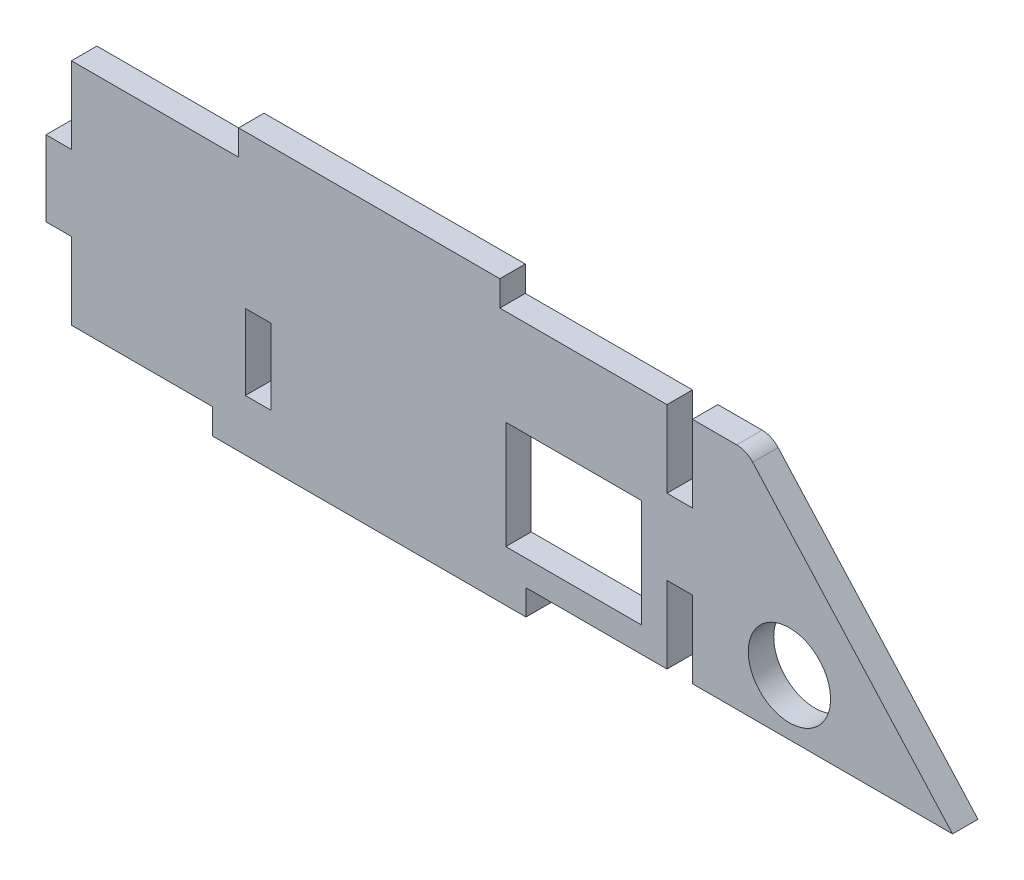
from build123d import *

# Parameters (mm, degrees)
SKETCH_1_W          = 76.2
SKETCH_1_H          = 30
EXTRUDE_1_DEPTH     = 3
SKETCH_2_W          = 19.6215
SKETCH_2_H          = 3
CUT_EXTRUDE_1_DEPTH = 3
SKETCH_3_W          = 3
SKETCH_3_H          = 9.055
CUT_EXTRUDE_2_DEPTH = 3
EXTRUDE_2_DEPTH     = 3
SKETCH_6_W          = 30.7975
SKETCH_6_H          = 3
EXTRUDE_3_DEPTH     = 3
SKETCH_7_W          = 16.002
SKETCH_7_H          = 12.7
CUT_EXTRUDE_3_DEPTH = 3
SKETCH_8_R          = 4.85
CUT_EXTRUDE_4_DEPTH = 3
FILLET_1_R          = 2.54
SKETCH_9_W          = 3
SKETCH_9_H          = 8.89
CUT_EXTRUDE_5_DEPTH = 3


with BuildPart() as part:
    # 스케치1 → 보스-돌출1 (new body)
    with BuildSketch(Plane.XY):
        Rectangle(SKETCH_1_W, SKETCH_1_H)
    extrude(amount=EXTRUDE_1_DEPTH)

    # 스케치2 → 컷-돌출1 (cut)
    with BuildSketch(Plane.XY.offset(3)):
        with Locations((-28.28925, -13.5)):
            Rectangle(SKETCH_2_W, SKETCH_2_H)
        with Locations((28.28925, -13.5)):
            Rectangle(SKETCH_2_W, SKETCH_2_H)
    extrude(amount=-CUT_EXTRUDE_1_DEPTH, mode=Mode.SUBTRACT)

    # 스케치3 → 컷-돌출2 (cut)
    with BuildSketch(Plane.XY.offset(3)):
        with Locations((-36.6, 10.4725)):
            Rectangle(SKETCH_3_W, SKETCH_3_H)
        with Locations((-36.6, -7.4725)):
            Rectangle(SKETCH_3_W, SKETCH_3_H)
        with Locations((36.6, 10.4725)):
            Rectangle(SKETCH_3_W, SKETCH_3_H)
        with Locations((36.6, -7.4725)):
            Rectangle(SKETCH_3_W, SKETCH_3_H)
    extrude(amount=-CUT_EXTRUDE_2_DEPTH, mode=Mode.SUBTRACT)

    # 스케치5 → 보스-돌출2 (add)
    with BuildSketch(Plane.XY.offset(3)):
        Polygon((44.45, -12), (68.760909196, -12), (44.45, 15), (38.1, 15), (38.1, -12), align=None)
    extrude(amount=-EXTRUDE_2_DEPTH)

    # 스케치6 → 보스-돌출3 (add)
    with BuildSketch(Plane.XY.offset(3)):
        with Locations((0, 16.5)):
            Rectangle(SKETCH_6_W, SKETCH_6_H)
    extrude(amount=-EXTRUDE_3_DEPTH)

    # 스케치7 → 컷-돌출3 (cut)
    with BuildSketch(Plane(origin=(0, 0, 0), x_dir=(-1, 0, 0), z_dir=(0, 0, -1))):
        with Locations((-24.099, -2.65)):
            Rectangle(SKETCH_7_W, SKETCH_7_H)
    extrude(amount=-CUT_EXTRUDE_3_DEPTH, mode=Mode.SUBTRACT)

    # 스케치8 → 컷-돌출4 (cut)
    with BuildSketch(Plane(origin=(0, 0, 0), x_dir=(-1, 0, 0), z_dir=(0, 0, -1))):
        with Locations((-49.53, -5.42)):
            Circle(SKETCH_8_R)
    extrude(amount=-CUT_EXTRUDE_4_DEPTH, mode=Mode.SUBTRACT)

    # 필렛1
    fillet_1_edges = [part.edges().sort_by_distance(p)[0] for p in [
        (44.45, 15, 1.5),
    ]]
    fillet(fillet_1_edges, radius=FILLET_1_R)

    # 스케치9 → 컷-돌출5 (cut)
    with BuildSketch(Plane(origin=(0, 0, 0), x_dir=(-1, 0, 0), z_dir=(0, 0, -1))):
        with Locations((13.1, -4.4802)):
            Rectangle(SKETCH_9_W, SKETCH_9_H)
    extrude(amount=-CUT_EXTRUDE_5_DEPTH, mode=Mode.SUBTRACT)


solid = part.part
